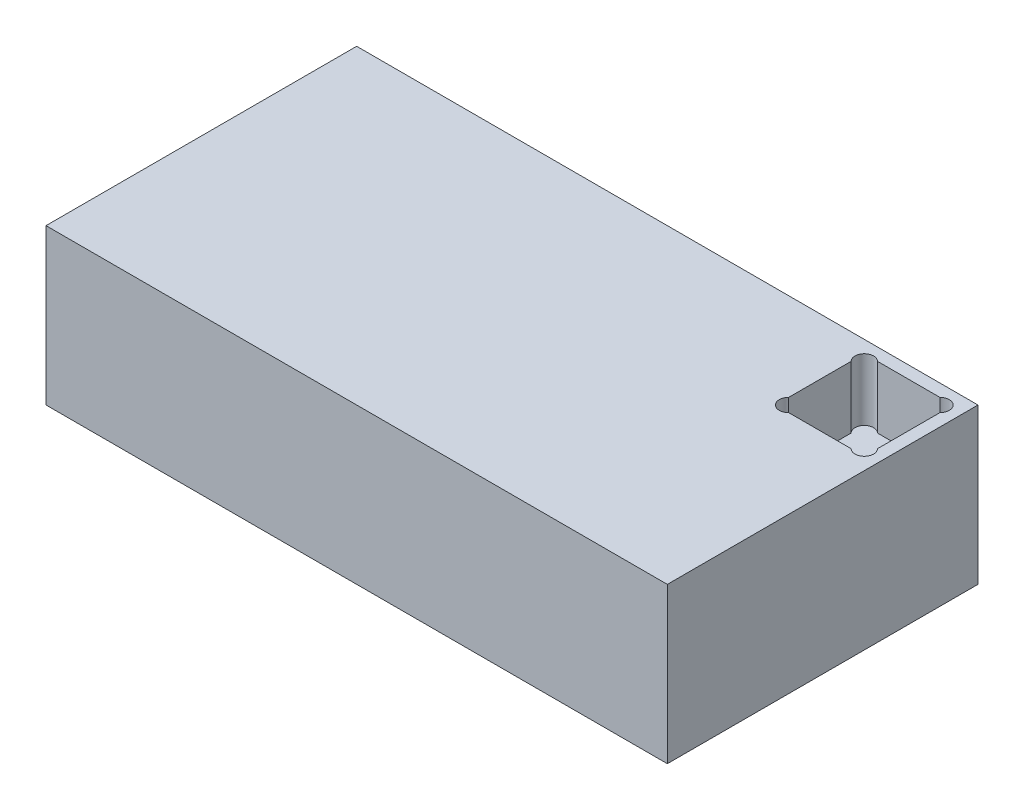
from build123d import *

# Parameters (mm, degrees)
SKETCH1_W           = 100
SKETCH1_H           = 50
BOSS_EXTRUDE1_DEPTH = 25
CUT_EXTRUDE1_DEPTH  = 10


with BuildPart() as part:
    # Sketch1 → Boss-Extrude1 (new body)
    with BuildSketch(Plane(origin=(0, 0, 0), x_dir=(1, 0, 0), z_dir=(0, 1, 0))):
        Rectangle(SKETCH1_W, SKETCH1_H)
    extrude(amount=-BOSS_EXTRUDE1_DEPTH)

    # Sketch2 → Cut-Extrude1 (cut)
    with BuildSketch(Plane(origin=(0, 0, 0), x_dir=(1, 0, 0), z_dir=(0, 1, 0))):
        with BuildLine():
            Line((33.7, 20.878679656), (33.7, 10.821320344))
            ThreePointArc((33.7, 10.821320344), (33.7, 8.7), (35.821320344, 8.7))
            Line((35.821320344, 8.7), (45.878679656, 8.7))
            ThreePointArc((45.878679656, 8.7), (48, 8.7), (48, 10.821320344))
            Line((48, 10.821320344), (48, 20.878679656))
            ThreePointArc((48, 20.878679656), (48, 23), (45.878679656, 23))
            Line((45.878679656, 23), (35.821320344, 23))
            ThreePointArc((35.821320344, 23), (33.7, 23), (33.7, 20.878679656))
        make_face()
    extrude(amount=-CUT_EXTRUDE1_DEPTH, mode=Mode.SUBTRACT)


solid = part.part
